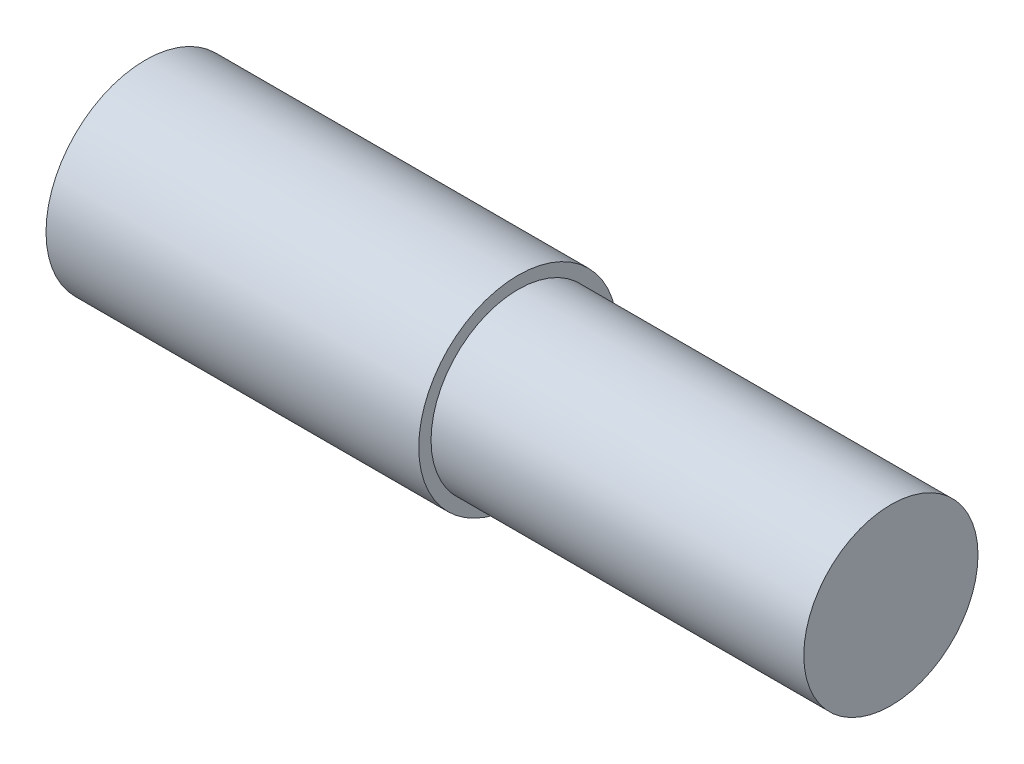
from build123d import *

# Parameters (mm, degrees)
SKETCH1_R           = 4
BOSS_EXTRUDE1_DEPTH = 15
SKETCH4_R           = 3.5052
BOSS_EXTRUDE2_DEPTH = 15


with BuildPart() as part:
    # Sketch1 → Boss-Extrude1 (new body)
    with BuildSketch(Plane(origin=(0, 0, 0), x_dir=(0, 0, -1), z_dir=(1, 0, 0))):
        Circle(SKETCH1_R)
    extrude(amount=BOSS_EXTRUDE1_DEPTH)

    # Sketch4 → Boss-Extrude2 (add)
    with BuildSketch(Plane(origin=(15, 0, 0), x_dir=(0, 0, -1), z_dir=(1, 0, 0))):
        Circle(SKETCH4_R)
    extrude(amount=BOSS_EXTRUDE2_DEPTH)


solid = part.part
